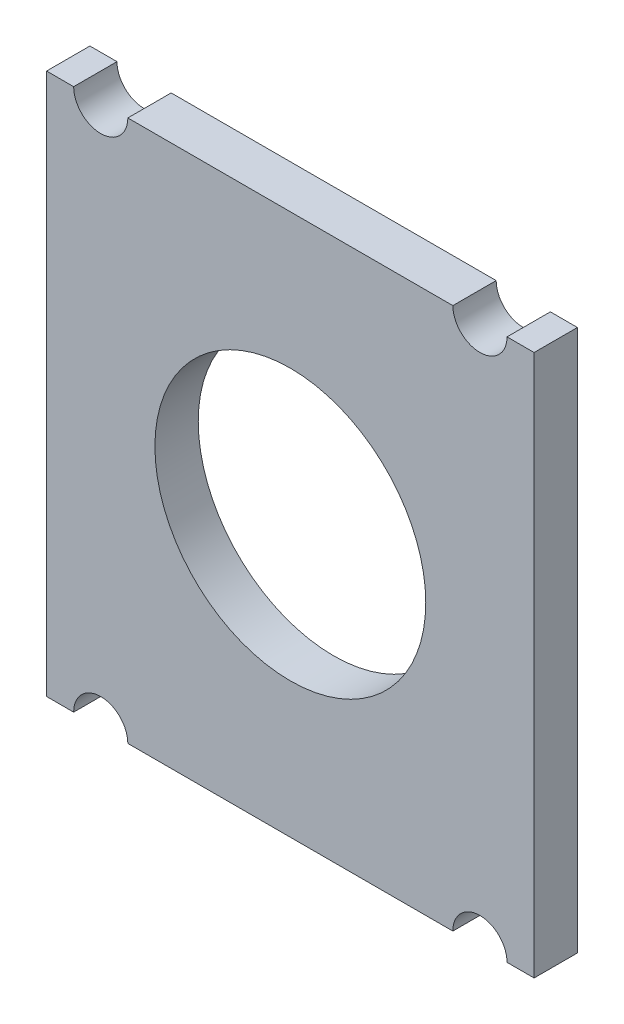
from build123d import *

# Parameters (mm, degrees)
SKETCH1_W              = 9
SKETCH1_H              = 10
BOARD_DEPTH            = 0.8
SKETCH2_R              = 2.5
NON_PLATED_HOLES_DEPTH = 14.816294728
SKETCH3_R              = 0.5
PLATED_HOLES_DEPTH     = 14.816294728


with BuildPart() as part:
    # Sketch1 → BOARD (new body)
    with BuildSketch(Plane.XY):
        with Locations((5, 5)):
            Rectangle(SKETCH1_W, SKETCH1_H)
    extrude(amount=BOARD_DEPTH)

    # Sketch2 → NON-PLATED HOLES (cut, through all)
    with BuildSketch(Plane.XY):
        with Locations((5, 5)):
            Circle(SKETCH2_R)
    extrude(amount=NON_PLATED_HOLES_DEPTH, mode=Mode.SUBTRACT)

    # Sketch3 → PLATED HOLES (cut, through all)
    with BuildSketch(Plane.XY):
        with Locations((1.5, 0)):
            Circle(SKETCH3_R)
        with Locations((1.5, 10)):
            Circle(SKETCH3_R)
        with Locations((8.5, 10)):
            Circle(SKETCH3_R)
        with Locations((8.5, 0)):
            Circle(SKETCH3_R)
    extrude(amount=PLATED_HOLES_DEPTH, mode=Mode.SUBTRACT)


solid = part.part
